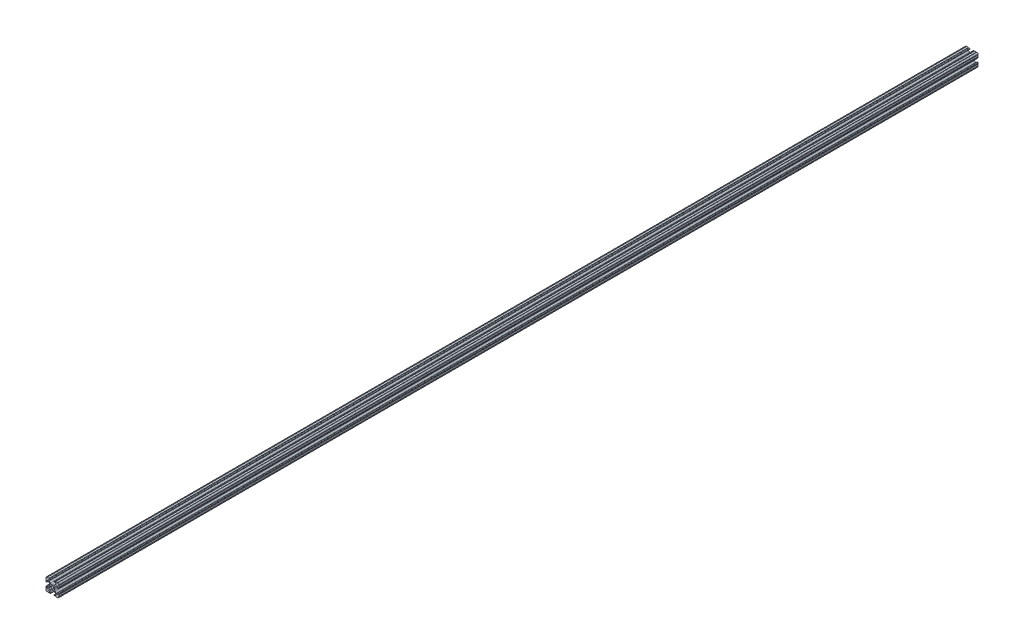
from build123d import *

# Parameters (mm, degrees)
SKETCH1_R               = 2.6035
BOSS_EXTRUDE1_DEPTH     = 914.4
CUT_EXTRUDE1_DEPTH      = 915.65008745
CUT_EXTRUDE1_DEPTH_BACK = 915.65008745
SKETCH2_R               = 3.175


with BuildPart() as part:
    # Sketch1 → Boss-Extrude1 (new, symmetric)
    with BuildSketch(Plane.XY):
        with BuildLine():
            Line((-7.179650497, -8.645192506), (-3.952270251, -5.423690499))
            ThreePointArc((-3.952270251, -5.423690499), (-2.922936451, -4.736929036), (-1.709253557, -4.4958))
            Line((-1.709253557, -4.4958), (1.709253557, -4.4958))
            ThreePointArc((1.709253557, -4.4958), (2.922936451, -4.736929036), (3.952270251, -5.423690499))
            Line((3.952270251, -5.423690499), (7.179650497, -8.645192506))
            ThreePointArc((7.179650497, -8.645192506), (7.41473083, -9.822813117), (6.416408329, -10.4902))
            Line((6.416408329, -10.4902), (4.287512407, -10.4902))
            ThreePointArc((4.287512407, -10.4902), (3.54574862, -10.79744862), (3.2385, -11.539212407))
            Line((3.2385, -11.539212407), (3.2385, -11.650987593))
            ThreePointArc((3.2385, -11.650987593), (3.54574862, -12.39275138), (4.287512407, -12.7))
            Line((4.287512407, -12.7), (5.317126718, -12.7))
            ThreePointArc((5.317126718, -12.7), (5.825126718, -12.192), (6.333126718, -12.7))
            Line((6.333126718, -12.7), (9.550443118, -12.7))
            ThreePointArc((9.550443118, -12.7), (10.058366869, -12.192000006), (10.566443095, -12.699847501))
            ThreePointArc((10.566443095, -12.699847501), (12.082537762, -12.08250727), (12.699846982, -10.566399977))
            ThreePointArc((12.699846982, -10.566399977), (12.192000006, -10.058323491), (12.7, -9.5504))
            Line((12.7, -9.5504), (12.7, -6.3330836))
            ThreePointArc((12.7, -6.3330836), (12.192, -5.8250836), (12.7, -5.3170836))
            Line((12.7, -5.3170836), (12.7, -4.287469289))
            ThreePointArc((12.7, -4.287469289), (12.39275138, -3.545705502), (11.650987593, -3.238456882))
            Line((11.650987593, -3.238456882), (11.539212407, -3.238456882))
            ThreePointArc((11.539212407, -3.238456882), (10.79744862, -3.545705502), (10.4902, -4.287469289))
            Line((10.4902, -4.287469289), (10.4902, -6.402089023))
            ThreePointArc((10.4902, -6.402089023), (9.856505071, -7.351067942), (8.737131347, -7.129408934))
            Line((8.737131347, -7.129408934), (5.441005833, -3.840816462))
            ThreePointArc((5.441005833, -3.840816462), (4.750877967, -2.809883091), (4.5085, -1.593185507))
            Line((4.5085, -1.593185507), (4.5085, 1.593185507))
            ThreePointArc((4.5085, 1.593185507), (4.750877967, 2.809883091), (5.441005833, 3.840816462))
            Line((5.441005833, 3.840816462), (8.737131347, 7.129408934))
            ThreePointArc((8.737131347, 7.129408934), (9.856505071, 7.351067942), (10.4902, 6.402089023))
            Line((10.4902, 6.402089023), (10.4902, 4.287469289))
            ThreePointArc((10.4902, 4.287469289), (10.79744862, 3.545705502), (11.539212407, 3.238456882))
            Line((11.539212407, 3.238456882), (11.650987593, 3.238456882))
            ThreePointArc((11.650987593, 3.238456882), (12.39275138, 3.545705502), (12.7, 4.287469289))
            Line((12.7, 4.287469289), (12.7, 5.3170836))
            ThreePointArc((12.7, 5.3170836), (12.192, 5.8250836), (12.7, 6.3330836))
            Line((12.7, 6.3330836), (12.7, 9.5504))
            ThreePointArc((12.7, 9.5504), (12.192000006, 10.058323491), (12.699846982, 10.566399977))
            ThreePointArc((12.699846982, 10.566399977), (12.082537762, 12.08250727), (10.566443095, 12.699847501))
            ThreePointArc((10.566443095, 12.699847501), (10.058366869, 12.192000006), (9.550443118, 12.7))
            Line((9.550443118, 12.7), (6.333126718, 12.7))
            ThreePointArc((6.333126718, 12.7), (5.825126718, 12.192), (5.317126718, 12.7))
            Line((5.317126718, 12.7), (4.287512407, 12.7))
            ThreePointArc((4.287512407, 12.7), (3.54574862, 12.39275138), (3.2385, 11.650987593))
            Line((3.2385, 11.650987593), (3.2385, 11.539212407))
            ThreePointArc((3.2385, 11.539212407), (3.54574862, 10.79744862), (4.287512407, 10.4902))
            Line((4.287512407, 10.4902), (6.476788598, 10.4902))
            ThreePointArc((6.476788598, 10.4902), (7.432222385, 9.85140422), (7.207036008, 8.724370562))
            Line((7.207036008, 8.724370562), (3.898272566, 5.423169045))
            ThreePointArc((3.898272566, 5.423169045), (2.869120213, 4.736787962), (1.655778399, 4.4958))
            Line((1.655778399, 4.4958), (-1.655778399, 4.4958))
            ThreePointArc((-1.655778399, 4.4958), (-2.869120213, 4.736787962), (-3.898272566, 5.423169045))
            Line((-3.898272566, 5.423169045), (-7.207036008, 8.724370562))
            ThreePointArc((-7.207036008, 8.724370562), (-7.432222385, 9.85140422), (-6.476788598, 10.4902))
            Line((-6.476788598, 10.4902), (-4.287512407, 10.4902))
            ThreePointArc((-4.287512407, 10.4902), (-3.54574862, 10.79744862), (-3.2385, 11.539212407))
            Line((-3.2385, 11.539212407), (-3.2385, 11.650987593))
            ThreePointArc((-3.2385, 11.650987593), (-3.54574862, 12.39275138), (-4.287512407, 12.7))
            Line((-4.287512407, 12.7), (-5.317126718, 12.7))
            ThreePointArc((-5.317126718, 12.7), (-5.825126718, 12.192), (-6.333126718, 12.7))
            Line((-6.333126718, 12.7), (-9.550443118, 12.7))
            ThreePointArc((-9.550443118, 12.7), (-10.058366869, 12.192000006), (-10.566443095, 12.699847501))
            ThreePointArc((-10.566443095, 12.699847501), (-12.082537762, 12.08250727), (-12.699846982, 10.566399977))
            ThreePointArc((-12.699846982, 10.566399977), (-12.192000006, 10.058323491), (-12.7, 9.5504))
            Line((-12.7, 9.5504), (-12.7, 6.3330836))
            ThreePointArc((-12.7, 6.3330836), (-12.192, 5.8250836), (-12.7, 5.3170836))
            Line((-12.7, 5.3170836), (-12.7, 4.287469289))
            ThreePointArc((-12.7, 4.287469289), (-12.39275138, 3.545705502), (-11.650987593, 3.238456882))
            Line((-11.650987593, 3.238456882), (-11.539212407, 3.238456882))
            ThreePointArc((-11.539212407, 3.238456882), (-10.79744862, 3.545705502), (-10.4902, 4.287469289))
            Line((-10.4902, 4.287469289), (-10.4902, 6.402089023))
            ThreePointArc((-10.4902, 6.402089023), (-9.856505071, 7.351067942), (-8.737131347, 7.129408934))
            Line((-8.737131347, 7.129408934), (-5.441005833, 3.840816462))
            ThreePointArc((-5.441005833, 3.840816462), (-4.750877967, 2.809883091), (-4.5085, 1.593185507))
            Line((-4.5085, 1.593185507), (-4.5085, -1.593185507))
            ThreePointArc((-4.5085, -1.593185507), (-4.750877967, -2.809883091), (-5.441005833, -3.840816462))
            Line((-5.441005833, -3.840816462), (-8.737131347, -7.129408934))
            ThreePointArc((-8.737131347, -7.129408934), (-9.856505071, -7.351067942), (-10.4902, -6.402089023))
            Line((-10.4902, -6.402089023), (-10.4902, -4.287469289))
            ThreePointArc((-10.4902, -4.287469289), (-10.79744862, -3.545705502), (-11.539212407, -3.238456882))
            Line((-11.539212407, -3.238456882), (-11.650987593, -3.238456882))
            ThreePointArc((-11.650987593, -3.238456882), (-12.39275138, -3.545705502), (-12.7, -4.287469289))
            Line((-12.7, -4.287469289), (-12.7, -5.3170836))
            ThreePointArc((-12.7, -5.3170836), (-12.192, -5.8250836), (-12.7, -6.3330836))
            Line((-12.7, -6.3330836), (-12.7, -9.5504))
            ThreePointArc((-12.7, -9.5504), (-12.192000006, -10.058323491), (-12.699846982, -10.566399977))
            ThreePointArc((-12.699846982, -10.566399977), (-12.082537762, -12.08250727), (-10.566443095, -12.699847501))
            ThreePointArc((-10.566443095, -12.699847501), (-10.058366869, -12.192000006), (-9.550443118, -12.7))
            Line((-9.550443118, -12.7), (-6.333126718, -12.7))
            ThreePointArc((-6.333126718, -12.7), (-5.825126718, -12.192), (-5.317126718, -12.7))
            Line((-5.317126718, -12.7), (-4.287512407, -12.7))
            ThreePointArc((-4.287512407, -12.7), (-3.54574862, -12.39275138), (-3.2385, -11.650987593))
            Line((-3.2385, -11.650987593), (-3.2385, -11.539212407))
            ThreePointArc((-3.2385, -11.539212407), (-3.54574862, -10.79744862), (-4.287512407, -10.4902))
            Line((-4.287512407, -10.4902), (-6.416408329, -10.4902))
            ThreePointArc((-6.416408329, -10.4902), (-7.41473083, -9.822813117), (-7.179650497, -8.645192506))
        make_face()
        Circle(SKETCH1_R, mode=Mode.SUBTRACT)
    extrude(amount=BOSS_EXTRUDE1_DEPTH, both=True)

    # Sketch2 → Cut-Extrude1 (cut, two sides: drawn at the far end of the back side and taken through both)
    with BuildSketch(Plane(origin=(4.5085, 0, 0), x_dir=(0, 0, -1), z_dir=(1, 0, 0)).offset(-CUT_EXTRUDE1_DEPTH_BACK)):
        with Locations(Location((0, 0, 0), (0, 0, 149.881456627))):
            Circle(SKETCH2_R)
        with Locations(Location((76.2, 0, 0), (0, 0, 149.881456627))):
            Circle(SKETCH2_R)
        with Locations(Location((-76.2, 0, 0), (0, 0, 149.881456627))):
            Circle(SKETCH2_R)
    extrude(amount=CUT_EXTRUDE1_DEPTH + CUT_EXTRUDE1_DEPTH_BACK, mode=Mode.SUBTRACT)


solid = part.part
